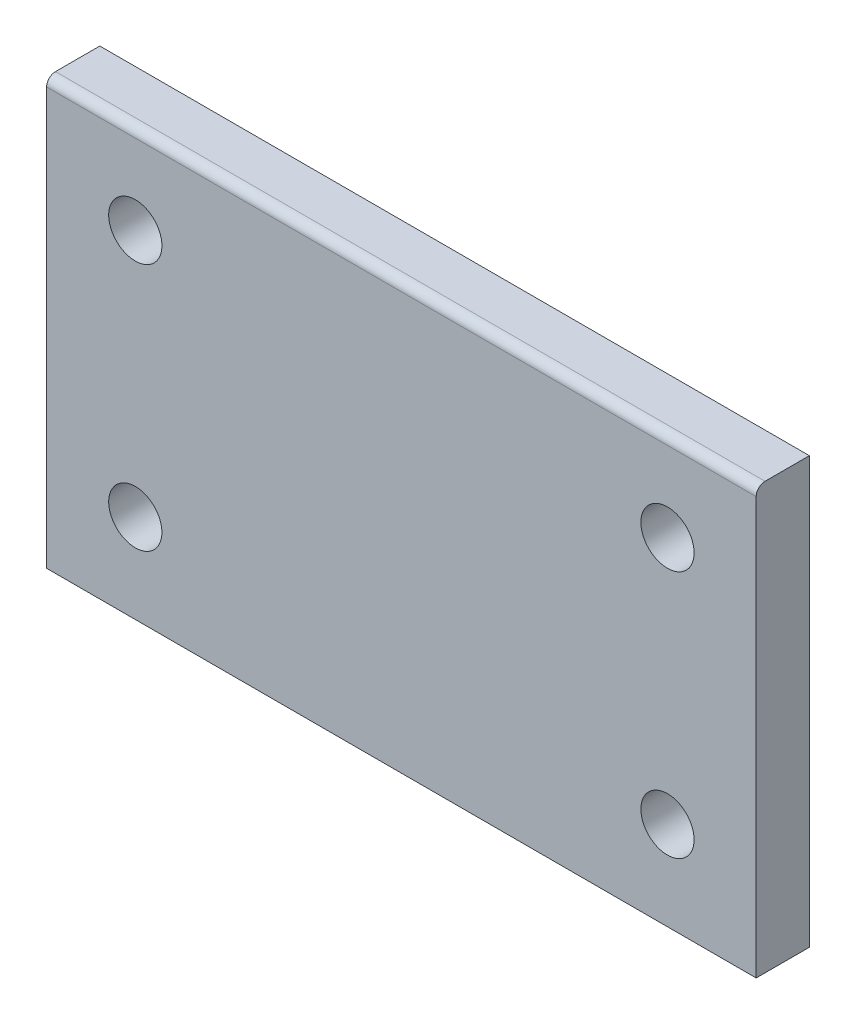
from build123d import *

# Parameters (mm, degrees)
SKETCH1_W   = 127
SKETCH1_H   = 76.2
BASE_DEPTH  = 9.525
SKETCH2_R   = 4.7625
HOLES_DEPTH = 149.412147835
FILLET2_R   = 1.5875


with BuildPart() as part:
    # Sketch1 → base (new body)
    with BuildSketch(Plane.XY):
        with Locations((63.5, 38.1)):
            Rectangle(SKETCH1_W, SKETCH1_H)
    extrude(amount=BASE_DEPTH)

    # Sketch2 → holes (cut, through all)
    with BuildSketch(Plane.XY):
        with Locations((15.875, 15.875)):
            Circle(SKETCH2_R)
        with Locations((111.125, 15.875)):
            Circle(SKETCH2_R)
        with Locations((15.875, 60.325)):
            Circle(SKETCH2_R)
        with Locations((111.125, 60.325)):
            Circle(SKETCH2_R)
    extrude(amount=HOLES_DEPTH, mode=Mode.SUBTRACT)

    # Fillet2
    fillet2_edges = [part.edges().sort_by_distance(p)[0] for p in [
        (63.5, 76.2, 9.525),
    ]]
    fillet(fillet2_edges, radius=FILLET2_R)


solid = part.part
